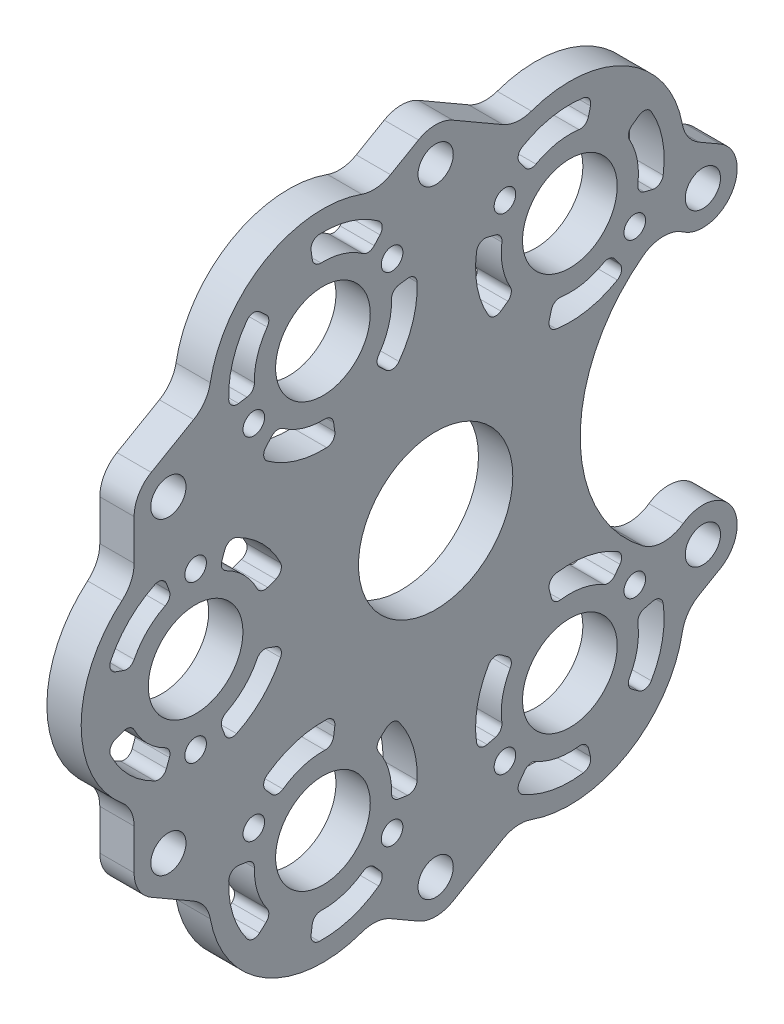
from build123d import *

# Parameters (mm, degrees)
SKETCH1_R                = 3.2639
SKETCH1_R_2              = 2
SKETCH1_R_3              = 8.763
SKETCH1_R_4              = 14.2875
BOSS_EXTRUDE1_DEPTH      = 6.35
FILLET1_R                = 6.35
CUT_EXTRUDE1_DEPTH       = 92.553313598
FILLET2_R                = 1.5875
CIRPATTERN4_COUNT        = 3
CIRPATTERN4_ANGLE        = 124
FILLET2_OF_CIRPATTERN4_R = 1.5875
CIRPATTERN5_COUNT        = 3
CIRPATTERN5_ANGLE        = 124
FILLET2_OF_CIRPATTERN5_R = 1.5875


with BuildPart() as part:
    # Sketch1 → Boss-Extrude1 (new body)
    with BuildSketch(Plane(origin=(0, 0, 0), x_dir=(0, 0, -1), z_dir=(1, 0, 0))):
        with BuildLine():
            Line((52.668351859, 34.074261295), (46.025977504, 37.909237917))
            ThreePointArc((46.025977504, 37.909237917), (35.454274559, 55.207254366), (15.187901406, 55.713609453))
            Line((15.187901406, 55.713609453), (0, 64.482348419))
            Line((0, 64.482348419), (-11.113986625, 58.065685249))
            ThreePointArc((-11.113986625, 58.065685249), (-31.466160966, 57.603554769), (-42.042464872, 40.209120007))
            Line((-42.042464872, 40.209120007), (-55.843351826, 32.241174209))
            Line((-55.843351826, 32.241174209), (-55.843351826, 17.873854309))
            ThreePointArc((-55.843351826, 17.873854309), (-65.6463, 0), (-55.843351826, -17.873854309))
            Line((-55.843351826, -17.873854309), (-55.843351826, -32.241174209))
            Line((-55.843351826, -32.241174209), (-42.042464872, -40.209120007))
            ThreePointArc((-42.042464872, -40.209120007), (-31.466160966, -57.603554769), (-11.113986625, -58.065685249))
            Line((-11.113986625, -58.065685249), (0, -64.482348419))
            Line((0, -64.482348419), (15.187901406, -55.713609453))
            ThreePointArc((15.187901406, -55.713609453), (35.454274559, -55.207254366), (46.025977504, -37.909237917))
            Line((46.025977504, -37.909237917), (52.668351725, -34.074261372))
            ThreePointArc((52.668351725, -34.074261372), (53.601371173, -23.732823108), (43.550208526, -26.338585971))
            ThreePointArc((43.550208526, -26.338585971), (26.777177617, 0), (43.550208526, 26.338585971))
            ThreePointArc((43.550208526, 26.338585971), (53.601371114, 23.732823059), (52.668351859, 34.074261295))
        make_face()
        with Locations((49.493351826, 28.575)):
            Circle(SKETCH1_R, mode=Mode.SUBTRACT)
        with Locations((49.493351826, -28.575)):
            Circle(SKETCH1_R, mode=Mode.SUBTRACT)
        with Locations((-33.670389054, -32.439875326)):
            Circle(SKETCH1_R_2, mode=Mode.SUBTRACT)
        with Locations((-8.065632878, -46.05416568)):
            Circle(SKETCH1_R_2, mode=Mode.SUBTRACT)
        with Locations((-20.868010966, -39.247020503)):
            Circle(SKETCH1_R_3, mode=Mode.SUBTRACT)
        with Locations((-49.493351826, -28.575)):
            Circle(SKETCH1_R, mode=Mode.SUBTRACT)
        with Locations((-44.45, -14.49959)):
            Circle(SKETCH1_R_2, mode=Mode.SUBTRACT)
        with Locations((0, -57.15)):
            Circle(SKETCH1_R, mode=Mode.SUBTRACT)
        Circle(SKETCH1_R_4, mode=Mode.SUBTRACT)
        with Locations((-44.45, 0)):
            Circle(SKETCH1_R_3, mode=Mode.SUBTRACT)
        with Locations((-44.45, 14.49959)):
            Circle(SKETCH1_R_2, mode=Mode.SUBTRACT)
        with Locations((-49.493351826, 28.575)):
            Circle(SKETCH1_R, mode=Mode.SUBTRACT)
        with Locations((-33.670389054, 32.439875326)):
            Circle(SKETCH1_R_2, mode=Mode.SUBTRACT)
        with Locations((-20.868010966, 39.247020503)):
            Circle(SKETCH1_R_3, mode=Mode.SUBTRACT)
        with Locations((-8.065632878, 46.05416568)):
            Circle(SKETCH1_R_2, mode=Mode.SUBTRACT)
        with Locations((36.876829456, 28.742652269)):
            Circle(SKETCH1_R_2, mode=Mode.SUBTRACT)
        with Locations((12.835419663, 44.958787931)):
            Circle(SKETCH1_R_2, mode=Mode.SUBTRACT)
        with Locations((0, 57.15)):
            Circle(SKETCH1_R, mode=Mode.SUBTRACT)
        with Locations((24.856124559, 36.8507201)):
            Circle(SKETCH1_R_3, mode=Mode.SUBTRACT)
        with Locations((36.876829456, -28.742652269)):
            Circle(SKETCH1_R_2, mode=Mode.SUBTRACT)
        with Locations((12.835419663, -44.958787931)):
            Circle(SKETCH1_R_2, mode=Mode.SUBTRACT)
        with Locations((24.856124559, -36.8507201)):
            Circle(SKETCH1_R_3, mode=Mode.SUBTRACT)
    extrude(amount=-BOSS_EXTRUDE1_DEPTH)

    # Fillet1
    fillet1_edges = [part.edges().sort_by_distance(p)[0] for p in [
        (-3.175, -26.338585971, -43.550208526),
        (-3.175, -37.909237917, -46.025977504),
        (-3.175, -55.713609453, -15.187901406),
        (-3.175, -64.482348419, 0),
        (-3.175, -58.065685249, 11.113986625),
        (-3.175, -40.209120007, 42.042464872),
        (-3.175, -32.241174209, 55.843351826),
        (-3.175, -17.873854309, 55.843351826),
        (-3.175, 17.873854309, 55.843351826),
        (-3.175, 32.241174209, 55.843351826),
        (-3.175, 40.209120007, 42.042464872),
        (-3.175, 58.065685249, 11.113986625),
        (-3.175, 64.482348419, 0),
        (-3.175, 55.713609453, -15.187901406),
        (-3.175, 37.909237917, -46.025977504),
        (-3.175, 26.338585971, -43.550208526),
    ]]
    fillet(fillet1_edges, radius=FILLET1_R)

    # Sketch2 → Cut-Extrude1 (cut, through all)
    with BuildSketch(Plane.ZY.offset(6.35)):
        with BuildLine():
            ThreePointArc((38.477473247, 16.40938239), (32.102147834, 12.347852166), (28.04061761, 5.972526753))
            Line((28.04061761, 5.972526753), (32.515903716, 4.34365582))
            ThreePointArc((32.515903716, 4.34365582), (35.469743879, 8.980256121), (40.10634418, 11.934096284))
            Line((40.10634418, 11.934096284), (38.477473247, 16.40938239))
        make_face()
        with BuildLine():
            Line((32.515903716, -4.34365582), (28.04061761, -5.972526753))
            ThreePointArc((28.04061761, -5.972526753), (32.102147834, -12.347852166), (38.477473247, -16.40938239))
            Line((38.477473247, -16.40938239), (40.10634418, -11.934096284))
            ThreePointArc((40.10634418, -11.934096284), (35.469743879, -8.980256121), (32.515903716, -4.34365582))
        make_face()
        with BuildLine():
            Line((60.85938239, -5.972526753), (56.384096284, -4.34365582))
            ThreePointArc((56.384096284, -4.34365582), (53.430256121, -8.980256121), (48.79365582, -11.934096284))
            Line((48.79365582, -11.934096284), (50.422526753, -16.40938239))
            ThreePointArc((50.422526753, -16.40938239), (56.797852166, -12.347852166), (60.85938239, -5.972526753))
        make_face()
        with BuildLine():
            ThreePointArc((60.85938239, 5.972526753), (56.797852166, 12.347852166), (50.422526753, 16.40938239))
            Line((50.422526753, 16.40938239), (48.79365582, 11.934096284))
            ThreePointArc((48.79365582, 11.934096284), (53.430256121, 8.980256121), (56.384096284, 4.34365582))
            Line((56.384096284, 4.34365582), (60.85938239, 5.972526753))
        make_face()
    cut_extrude1 = extrude(amount=-CUT_EXTRUDE1_DEPTH, mode=Mode.SUBTRACT)

    # Fillet2
    fillet2_edges = [part.edges().sort_by_distance(p)[0] for p in [
        (-3.175, 4.34365582, 56.384096284),
        (-3.175, 11.934096284, 48.79365582),
        (-3.175, 16.40938239, 50.422526753),
        (-3.175, 5.972526753, 60.85938239),
        (-3.175, -11.934096284, 48.79365582),
        (-3.175, -4.34365582, 56.384096284),
        (-3.175, -5.972526753, 60.85938239),
        (-3.175, -16.40938239, 50.422526753),
        (-3.175, -4.34365582, 32.515903716),
        (-3.175, -11.934096284, 40.10634418),
        (-3.175, -16.40938239, 38.477473247),
        (-3.175, -5.972526753, 28.04061761),
        (-3.175, 11.934096284, 40.10634418),
        (-3.175, 4.34365582, 32.515903716),
        (-3.175, 5.972526753, 28.04061761),
        (-3.175, 16.40938239, 38.477473247),
    ]]
    fillet(fillet2_edges, radius=FILLET2_R)

    # CirPattern4: Cut-Extrude1 ×3 about axis
    cirpattern4_axis = Axis((0, 0, 0), (1, 0, 0))
    for i in range(1, CIRPATTERN4_COUNT):
        add(cut_extrude1.rotate(cirpattern4_axis, i * CIRPATTERN4_ANGLE / (CIRPATTERN4_COUNT - 1)), mode=Mode.SUBTRACT)

    # Fillet2 of CirPattern4
    fillet2_of_cirpattern4_edges = [part.edges().sort_by_distance(p)[0] for p in [
        (-3.175, -47.744979203, 30.305950249),
        (-3.175, -37.47952212, 33.444415439),
        (-3.175, -36.816710227, 38.160567116),
        (-3.175, -50.931713716, 33.845177481),
        (-3.175, -48.684959786, 12.370052265),
        (-3.175, -51.823424976, 22.635509348),
        (-3.175, -56.539576653, 23.298321241),
        (-3.175, -52.224187017, 9.183317752),
        (-3.175, -30.749061802, 11.430071682),
        (-3.175, -41.014518885, 8.291606493),
        (-3.175, -41.677330778, 3.575454815),
        (-3.175, -27.562327289, 7.890844451),
        (-3.175, -29.809081219, 29.365969667),
        (-3.175, -26.67061603, 19.100512584),
        (-3.175, -21.954464352, 18.43770069),
        (-3.175, -26.269853988, 32.552704179),
        (-3.175, -49.173475824, -27.928532633),
        (-3.175, -47.125235929, -17.391251855),
        (-3.175, -50.978179364, -14.591924591),
        (-3.175, -53.79450922, -29.080685661),
        (-3.175, -33.778312026, -37.178880283),
        (-3.175, -44.315592804, -35.130640388),
        (-3.175, -47.114920068, -38.983583824),
        (-3.175, -32.626158998, -41.799913679),
        (-3.175, -24.527964376, -21.783716485),
        (-3.175, -26.576204272, -32.320997263),
        (-3.175, -22.723260836, -35.120324527),
        (-3.175, -19.90693098, -20.631563457),
        (-3.175, -39.923128174, -12.533368836),
        (-3.175, -29.385847396, -14.581608731),
        (-3.175, -26.586520132, -10.728665295),
        (-3.175, -41.075281202, -7.912335439),
    ]]
    fillet(fillet2_of_cirpattern4_edges, radius=FILLET2_OF_CIRPATTERN4_R)

    # CirPattern5: Cut-Extrude1 ×3 about axis
    cirpattern5_axis = Axis((0, 0, 0), (-1, 0, 0))
    for i in range(1, CIRPATTERN5_COUNT):
        add(cut_extrude1.rotate(cirpattern5_axis, i * CIRPATTERN5_ANGLE / (CIRPATTERN5_COUNT - 1)), mode=Mode.SUBTRACT)

    # Fillet2 of CirPattern5
    fillet2_of_cirpattern5_edges = [part.edges().sort_by_distance(p)[0] for p in [
        (-3.175, 51.823424976, 22.635509348),
        (-3.175, 48.684959786, 12.370052265),
        (-3.175, 52.224187017, 9.183317752),
        (-3.175, 56.539576653, 23.298321241),
        (-3.175, 37.47952212, 33.444415439),
        (-3.175, 47.744979203, 30.305950249),
        (-3.175, 50.931713716, 33.845177481),
        (-3.175, 36.816710227, 38.160567116),
        (-3.175, 26.67061603, 19.100512584),
        (-3.175, 29.809081219, 29.365969667),
        (-3.175, 26.269853988, 32.552704179),
        (-3.175, 21.954464352, 18.43770069),
        (-3.175, 41.014518885, 8.291606493),
        (-3.175, 30.749061802, 11.430071682),
        (-3.175, 27.562327289, 7.890844451),
        (-3.175, 41.677330778, 3.575454815),
        (-3.175, 44.315592804, -35.130640388),
        (-3.175, 33.778312026, -37.178880283),
        (-3.175, 32.626158998, -41.799913679),
        (-3.175, 47.114920068, -38.983583824),
        (-3.175, 47.125235929, -17.391251855),
        (-3.175, 49.173475824, -27.928532633),
        (-3.175, 53.79450922, -29.080685661),
        (-3.175, 50.978179364, -14.591924591),
        (-3.175, 29.385847396, -14.581608731),
        (-3.175, 39.923128174, -12.533368836),
        (-3.175, 41.075281202, -7.912335439),
        (-3.175, 26.586520132, -10.728665295),
        (-3.175, 26.576204272, -32.320997263),
        (-3.175, 24.527964376, -21.783716485),
        (-3.175, 19.90693098, -20.631563457),
        (-3.175, 22.723260836, -35.120324527),
    ]]
    fillet(fillet2_of_cirpattern5_edges, radius=FILLET2_OF_CIRPATTERN5_R)


solid = part.part
